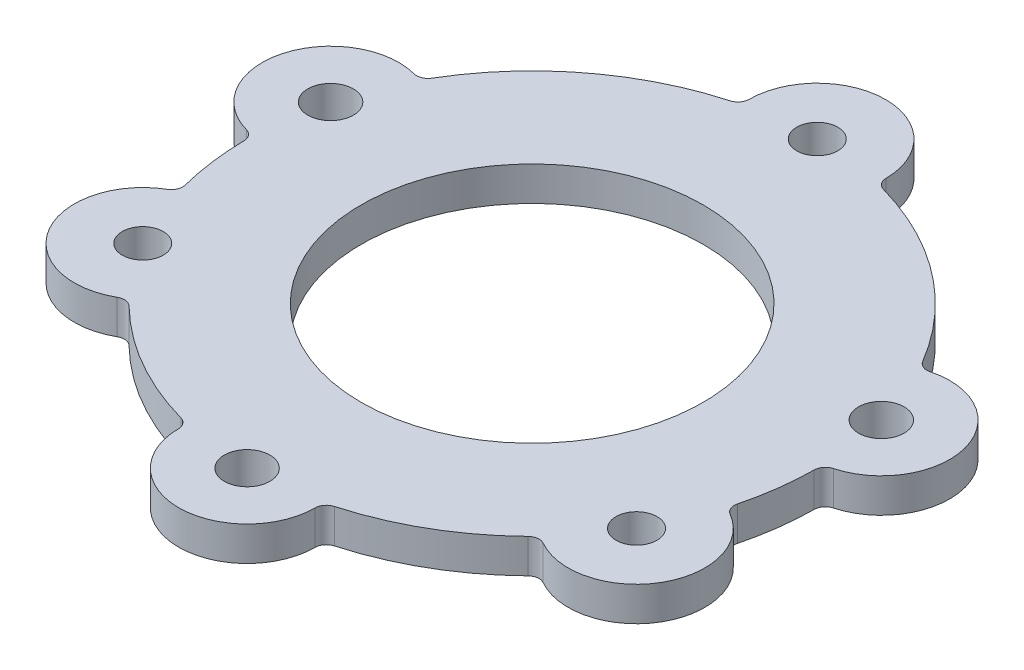
from build123d import *

# Parameters (mm, degrees)
BOSS_EXTRUDE1_DEPTH = 1.5
FILLET1_R           = 0.5


with BuildPart() as part:
    # Sketch1 → Boss-Extrude1 (new body)
    with BuildSketch(Plane(origin=(0, 0, 0), x_dir=(1, 0, 0), z_dir=(0, 1, 0))):
        with BuildLine():
            ThreePointArc((0.899416611, 12.4676), (1.956802124, 12.345886985), (3, 12.1346611))
            Line((3, 12.1346611), (3, 12.5))
            ThreePointArc((3, 12.5), (0, 15.5), (-3, 12.5))
            Line((-3, 12.5), (-3, 12.1346611))
            ThreePointArc((-3, 12.1346611), (-1.956802124, 12.345886985), (-0.899416611, 12.4676))
            ThreePointArc((-0.899416611, 12.4676), (-0.016202626, 13.399854141), (0.9, 12.5))
            ThreePointArc((0.9, 12.5), (0.899854141, 12.483797374), (0.899416611, 12.4676))
        make_face()
        with BuildLine():
            ThreePointArc((-3, 6.873863542), (0, 7.5), (3, 6.873863542))
            Line((3, 6.873863542), (3, 12.1346611))
            ThreePointArc((3, 12.1346611), (1.956802124, 12.345886985), (0.899416611, 12.4676))
            ThreePointArc((0.899416611, 12.4676), (0, 11.6), (-0.899416611, 12.4676))
            ThreePointArc((-0.899416611, 12.4676), (-1.956802124, 12.345886985), (-3, 12.1346611))
            Line((-3, 12.1346611), (-3, 6.873863542))
        make_face()
        with BuildLine():
            Line((3, 12.1346611), (3, 6.873863542))
            ThreePointArc((3, 6.873863542), (4.565710718, 5.950150052), (5.863185187, 4.676864277))
            Line((5.863185187, 4.676864277), (10.944725414, 6.038458877))
            ThreePointArc((10.944725414, 6.038458877), (7.609517863, 9.916916754), (3, 12.1346611))
        make_face()
        with BuildLine():
            ThreePointArc((7.5, 0), (7.48822587, -0.420087268), (7.45294045, -0.83885556))
            Line((7.45294045, -0.83885556), (7.772310826, -1.023244132))
            Line((7.772310826, -1.023244132), (12.497639685, 0.24290392))
            ThreePointArc((12.497639685, 0.24290392), (12.43679381, 1.255451998), (12.294047703, 2.259732526))
            ThreePointArc((12.294047703, 2.259732526), (11.108147002, 2.976419019), (11.776823889, 4.190038078))
            ThreePointArc((11.776823889, 4.190038078), (11.39830538, 5.131143582), (10.944725414, 6.038458877))
            Line((10.944725414, 6.038458877), (5.863185187, 4.676864277))
            ThreePointArc((5.863185187, 4.676864277), (7.078979054, 2.477509949), (7.5, 0))
        make_face()
        with BuildLine():
            ThreePointArc((12.294047703, 2.259732526), (12.43679381, 1.255451998), (12.497639685, 0.24290392))
            Line((12.497639685, 0.24290392), (12.850529964, 0.337460585))
            ThreePointArc((12.850529964, 0.337460585), (14.971850307, 4.011695199), (11.297615693, 6.133015543))
            Line((11.297615693, 6.133015543), (10.944725414, 6.038458877))
            ThreePointArc((10.944725414, 6.038458877), (11.39830538, 5.131143582), (11.776823889, 4.190038078))
            ThreePointArc((11.776823889, 4.190038078), (12.666842202, 4.040610319), (13.074072829, 3.235238064))
            ThreePointArc((13.074072829, 3.235238064), (12.855089754, 2.610728206), (12.294047703, 2.259732526))
        make_face()
        with BuildLine():
            Line((12.497639685, 0.24290392), (7.772310826, -1.023244132))
            Line((7.772310826, -1.023244132), (12.008924778, -3.469254338))
            ThreePointArc((12.008924778, -3.469254338), (12.376622312, -1.751918986), (12.5, 0))
            ThreePointArc((12.5, 0), (12.499409907, 0.121457693), (12.497639685, 0.24290392))
        make_face()
        with BuildLine():
            ThreePointArc((7.45294045, -0.83885556), (7.43583646, -0.978946442), (7.416099457, -1.118690681))
            Line((7.416099457, -1.118690681), (7.772310826, -1.023244132))
            Line((7.772310826, -1.023244132), (7.45294045, -0.83885556))
        make_face()
        with BuildLine():
            Line((7.772310826, -1.023244132), (7.416099457, -1.118690681))
            ThreePointArc((7.416099457, -1.118690681), (6.42347811, -3.871553818), (4.45294045, -6.035007983))
            Line((4.45294045, -6.035007983), (9.008924778, -8.665406761))
            ThreePointArc((9.008924778, -8.665406761), (9.713450699, -7.867583842), (10.347550019, -7.012717634))
            ThreePointArc((10.347550019, -7.012717634), (10.045894684, -5.8), (11.24696663, -5.454882366))
            ThreePointArc((11.24696663, -5.454882366), (11.670252823, -4.478303143), (12.008924778, -3.469254338))
            Line((12.008924778, -3.469254338), (7.772310826, -1.023244132))
        make_face()
        with BuildLine():
            ThreePointArc((10.347550019, -7.012717634), (9.713450699, -7.867583842), (9.008924778, -8.665406761))
            Line((9.008924778, -8.665406761), (9.325317547, -8.848076211))
            ThreePointArc((9.325317547, -8.848076211), (13.423393759, -7.75), (12.325317547, -3.651923789))
            Line((12.325317547, -3.651923789), (12.008924778, -3.469254338))
            ThreePointArc((12.008924778, -3.469254338), (11.670252823, -4.478303143), (11.24696663, -5.454882366))
            ThreePointArc((11.24696663, -5.454882366), (11.59651278, -5.786041044), (11.725317547, -6.25))
            ThreePointArc((11.725317547, -6.25), (11.261212732, -7.037397859), (10.347550019, -7.012717634))
        make_face()
        with BuildLine():
            ThreePointArc((4.45294045, -6.035007983), (3.75, -6.495190528), (3, -6.873863542))
            Line((3, -6.873863542), (3, -12.1346611))
            ThreePointArc((3, -12.1346611), (6.25, -10.825317547), (9.008924778, -8.665406761))
            Line((9.008924778, -8.665406761), (4.45294045, -6.035007983))
        make_face()
        with BuildLine():
            Line((3, -12.1346611), (3, -6.873863542))
            ThreePointArc((3, -6.873863542), (0, -7.5), (-3, -6.873863542))
            Line((-3, -6.873863542), (-3, -12.1346611))
            ThreePointArc((-3, -12.1346611), (-2.00620559, -12.337955225), (-0.99919968, -12.46))
            ThreePointArc((-0.99919968, -12.46), (0, -11.5), (0.99919968, -12.46))
            ThreePointArc((0.99919968, -12.46), (2.00620559, -12.337955225), (3, -12.1346611))
        make_face()
        with BuildLine():
            Line((3, -12.5), (3, -12.1346611))
            ThreePointArc((3, -12.1346611), (2.00620559, -12.337955225), (0.99919968, -12.46))
            ThreePointArc((0.99919968, -12.46), (0.9997999, -12.479995997), (1, -12.5))
            ThreePointArc((1, -12.5), (-0.020004003, -13.4997999), (-0.99919968, -12.46))
            ThreePointArc((-0.99919968, -12.46), (-2.00620559, -12.337955225), (-3, -12.1346611))
            Line((-3, -12.1346611), (-3, -12.5))
            ThreePointArc((-3, -12.5), (0, -15.5), (3, -12.5))
        make_face()
        with BuildLine():
            Line((-3, -12.1346611), (-3, -6.873863542))
            ThreePointArc((-3, -6.873863542), (-3.75, -6.495190528), (-4.45294045, -6.035007983))
            Line((-4.45294045, -6.035007983), (-9.008924778, -8.665406761))
            ThreePointArc((-9.008924778, -8.665406761), (-6.25, -10.825317547), (-3, -12.1346611))
        make_face()
        with BuildLine():
            Line((-9.008924778, -8.665406761), (-4.45294045, -6.035007983))
            ThreePointArc((-4.45294045, -6.035007983), (-6.42347811, -3.871553818), (-7.416099457, -1.118690681))
            Line((-7.416099457, -1.118690681), (-7.772310826, -1.023244132))
            Line((-7.772310826, -1.023244132), (-12.008924778, -3.469254338))
            ThreePointArc((-12.008924778, -3.469254338), (-11.670252823, -4.478303143), (-11.24696663, -5.454882366))
            ThreePointArc((-11.24696663, -5.454882366), (-10.361358591, -5.478804767), (-9.925317547, -6.25))
            ThreePointArc((-9.925317547, -6.25), (-10.037919689, -6.685895185), (-10.347550019, -7.012717634))
            ThreePointArc((-10.347550019, -7.012717634), (-9.713450699, -7.867583842), (-9.008924778, -8.665406761))
        make_face()
        with BuildLine():
            Line((-9.325317547, -8.848076211), (-9.008924778, -8.665406761))
            ThreePointArc((-9.008924778, -8.665406761), (-9.713450699, -7.867583842), (-10.347550019, -7.012717634))
            ThreePointArc((-10.347550019, -7.012717634), (-11.604740411, -6.7), (-11.24696663, -5.454882366))
            ThreePointArc((-11.24696663, -5.454882366), (-11.670252823, -4.478303143), (-12.008924778, -3.469254338))
            Line((-12.008924778, -3.469254338), (-12.325317547, -3.651923789))
            ThreePointArc((-12.325317547, -3.651923789), (-13.423393759, -7.75), (-9.325317547, -8.848076211))
        make_face()
        with BuildLine():
            Line((-7.772310826, -1.023244132), (-7.416099457, -1.118690681))
            ThreePointArc((-7.416099457, -1.118690681), (-7.43583646, -0.978946442), (-7.45294045, -0.83885556))
            Line((-7.45294045, -0.83885556), (-7.772310826, -1.023244132))
        make_face()
        with BuildLine():
            Line((-12.008924778, -3.469254338), (-7.772310826, -1.023244132))
            Line((-7.772310826, -1.023244132), (-12.497639685, 0.24290392))
            ThreePointArc((-12.497639685, 0.24290392), (-12.393060767, -1.631577403), (-12.008924778, -3.469254338))
        make_face()
        with BuildLine():
            ThreePointArc((-7.45294045, -0.83885556), (-7.206635264, 2.07711535), (-5.863185187, 4.676864277))
            Line((-5.863185187, 4.676864277), (-10.944725414, 6.038458877))
            ThreePointArc((-10.944725414, 6.038458877), (-11.39830538, 5.131143582), (-11.776823889, 4.190038078))
            ThreePointArc((-11.776823889, 4.190038078), (-11.268700573, 3.828007437), (-11.074072829, 3.235238064))
            ThreePointArc((-11.074072829, 3.235238064), (-11.44956297, 2.454221139), (-12.294047703, 2.259732526))
            ThreePointArc((-12.294047703, 2.259732526), (-12.43679381, 1.255451998), (-12.497639685, 0.24290392))
            Line((-12.497639685, 0.24290392), (-7.772310826, -1.023244132))
            Line((-7.772310826, -1.023244132), (-7.45294045, -0.83885556))
        make_face()
        with BuildLine():
            ThreePointArc((-11.776823889, 4.190038078), (-11.39830538, 5.131143582), (-10.944725414, 6.038458877))
            Line((-10.944725414, 6.038458877), (-11.297615693, 6.133015543))
            ThreePointArc((-11.297615693, 6.133015543), (-14.971850307, 4.011695199), (-12.850529964, 0.337460585))
            Line((-12.850529964, 0.337460585), (-12.497639685, 0.24290392))
            ThreePointArc((-12.497639685, 0.24290392), (-12.43679381, 1.255451998), (-12.294047703, 2.259732526))
            ThreePointArc((-12.294047703, 2.259732526), (-13.039998655, 3.494057109), (-11.776823889, 4.190038078))
        make_face()
        with BuildLine():
            ThreePointArc((-5.863185187, 4.676864277), (-4.565710718, 5.950150052), (-3, 6.873863542))
            Line((-3, 6.873863542), (-3, 12.1346611))
            ThreePointArc((-3, 12.1346611), (-7.609517863, 9.916916754), (-10.944725414, 6.038458877))
            Line((-10.944725414, 6.038458877), (-5.863185187, 4.676864277))
        make_face()
    extrude(amount=BOSS_EXTRUDE1_DEPTH)

    # Fillet1
    fillet1_edges = [part.edges().sort_by_distance(p)[0] for p in [
        (-3, 0.75, 12.1346611),
        (3, 0.75, 12.1346611),
        (9.008924778, 0.75, 8.665406761),
        (12.008924778, 0.75, 3.469254338),
        (12.497639685, 0.75, -0.24290392),
        (10.944725414, 0.75, -6.038458877),
        (3, 0.75, -12.1346611),
        (-3, 0.75, -12.1346611),
        (-10.944725414, 0.75, -6.038458877),
        (-12.497639685, 0.75, -0.24290392),
        (-12.008924778, 0.75, 3.469254338),
        (-9.008924778, 0.75, 8.665406761),
    ]]
    fillet(fillet1_edges, radius=FILLET1_R)


solid = part.part
